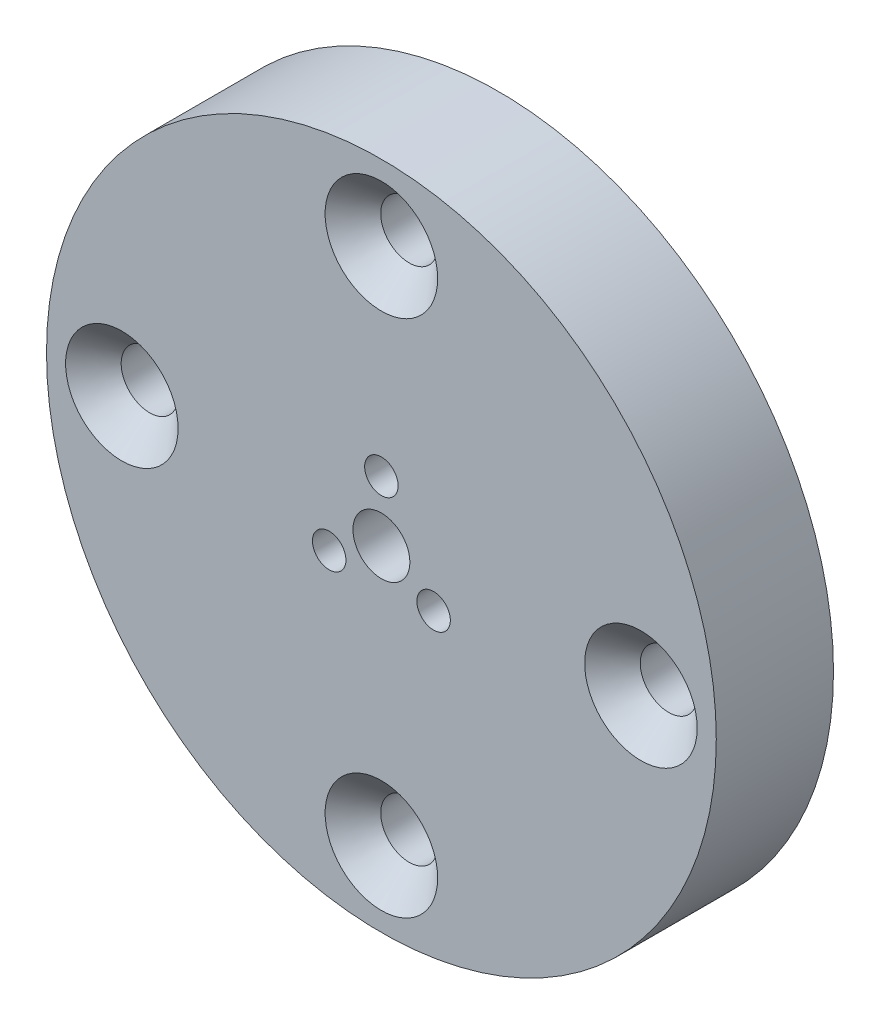
from build123d import *

# Parameters (mm, degrees)
CROQUIS1_R                                           = 20
CROQUIS1_R_2                                         = 1
SALIENTE_EXTRUIR1_DEPTH                              = 7
REFRENTADO_PARA_TORNILLO_TAP_N_CON_CABEZ_D           = 3.4
REFRENTADO_PARA_TORNILLO_TAP_N_CON_CABEZ_CSINK_D     = 6.72
REFRENTADO_PARA_TORNILLO_TAP_N_CON_CABEZ_CSINK_ANGLE = 90
TALADRO_DE_MARGEN_PARA_M31_D                         = 3.4
CROQUIS8_R                                           = 5
CORTAR_EXTRUIR1_DEPTH                                = 3


with BuildPart() as part:
    # Croquis1 → Saliente-Extruir1 (new body)
    with BuildSketch(Plane.XY):
        Circle(CROQUIS1_R)
        with Locations((0, 3.6)):
            Circle(CROQUIS1_R_2, mode=Mode.SUBTRACT)
        with Locations((3.117691454, -1.8)):
            Circle(CROQUIS1_R_2, mode=Mode.SUBTRACT)
        with Locations((-3.117691454, -1.8)):
            Circle(CROQUIS1_R_2, mode=Mode.SUBTRACT)
    extrude(amount=SALIENTE_EXTRUIR1_DEPTH)

    # Refrentado para tornillo tapón con cabeza plana de clavija de M31 (through all)
    with Locations(Plane.XY.offset(7)):
        with Locations((0, 15.5), (15.5, 0), (0, -15.5), (-15.5, 0)):
            CounterSinkHole(REFRENTADO_PARA_TORNILLO_TAP_N_CON_CABEZ_D / 2, REFRENTADO_PARA_TORNILLO_TAP_N_CON_CABEZ_CSINK_D / 2, counter_sink_angle=REFRENTADO_PARA_TORNILLO_TAP_N_CON_CABEZ_CSINK_ANGLE)

    # Taladro de margen para M31 (through all)
    with Locations(Plane.XY.offset(7)):
        with Locations((0, 0)):
            Hole(TALADRO_DE_MARGEN_PARA_M31_D / 2)

    # Croquis8 → Cortar-Extruir1 (cut)
    with BuildSketch(Plane(origin=(0, 0, 0), x_dir=(-1, 0, 0), z_dir=(0, 0, -1))):
        Circle(CROQUIS8_R)
    extrude(amount=-CORTAR_EXTRUIR1_DEPTH, mode=Mode.SUBTRACT)


solid = part.part
